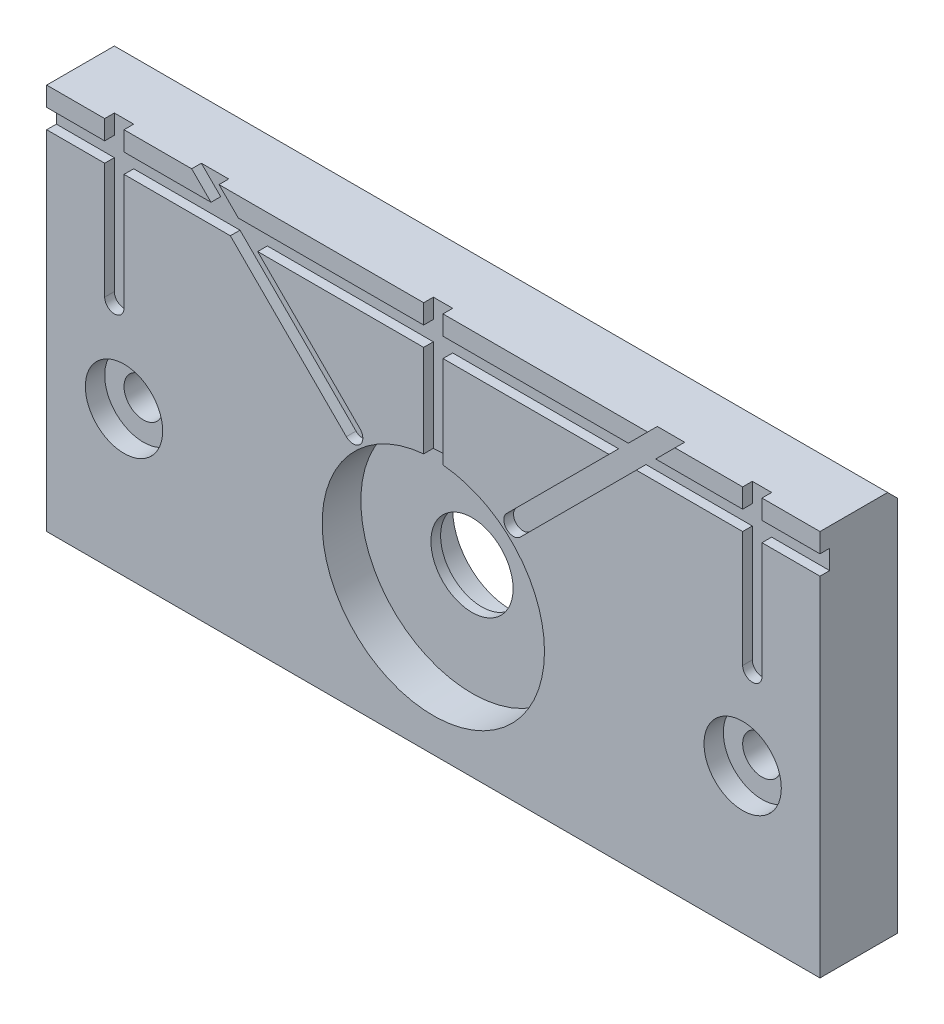
from build123d import *

# Parameters (mm, degrees)
SKETCH_1_W                     = 80
SKETCH_1_H                     = 60
EXTRUDE_1_DEPTH                = 8
HOLE_WIZARD_M3_5_1_D           = 4
HOLE_WIZARD_M3_5_1_CBORE_D     = 8
HOLE_WIZARD_M3_5_1_CBORE_DEPTH = 2
SKETCH_14_W                    = 80
SKETCH_14_H                    = 2
SKETCH_14_W_2                  = 2
SKETCH_14_H_2                  = 16
CUT_EXTRUDE_1_DEPTH            = 1
CUT_EXTRUDE_2_REACH            = 92.174
SKETCH_15_R                    = 4.25
SKETCH_17_R                    = 11.5
CUT_EXTRUDE_4_DEPTH            = 4
SKETCH_18_R                    = 6
CUT_EXTRUDE_5_DEPTH            = 3
CHAMFER_1_SIZE                 = 1.499999999
CHAMFER_1_SIZE2                = 1.500000001
CHAMFER_2_SIZE                 = 1
SKETCH_20_W                    = 80
SKETCH_20_H                    = 6
CUT_EXTRUDE_6_DEPTH            = 1
SKETCH_21_W                    = 80
SKETCH_21_H                    = 4
CUT_EXTRUDE_7_DEPTH            = 1
SKETCH_22_W                    = 80
SKETCH_22_H                    = 2
CUT_EXTRUDE_8_DEPTH            = 1
SKETCH_23_R                    = 1
CUT_EXTRUDE_9_DEPTH            = 1
CUT_EXTRUDE_10_REACH           = 92.174
SKETCH_24_W                    = 80
SKETCH_24_H                    = 20


with BuildPart() as part:
    # 草图1 → 凸台-拉伸1 (new body)
    with BuildSketch(Plane.XY.offset(8)):
        with Locations((40, 10.833333333)):
            Rectangle(SKETCH_1_W, SKETCH_1_H)
    extrude(amount=-EXTRUDE_1_DEPTH)

    # M3.5 六角头机械螺钉的柱形沉头孔1 (through all)
    with Locations(Plane.XY.offset(8)):
        with Locations((8, 15.833333333), (72, 15.833333333)):
            CounterBoreHole(HOLE_WIZARD_M3_5_1_D / 2, HOLE_WIZARD_M3_5_1_CBORE_D / 2, HOLE_WIZARD_M3_5_1_CBORE_DEPTH)

    # 草图14 → 切除-拉伸1 (cut)
    with BuildSketch(Plane.XY.offset(8)):
        with Locations((40, 37.833333333)):
            Rectangle(SKETCH_14_W, SKETCH_14_H)
        Polygon((15, 40.833333333), (31, 24.833333333), (32.414213562, 26.247546896), (16.414213562, 42.247546896), align=None)
        with Locations((7, 32.833333333)):
            Rectangle(SKETCH_14_W_2, SKETCH_14_H_2)
        with Locations((40, 32.833333333)):
            Rectangle(SKETCH_14_W_2, SKETCH_14_H_2)
        with Locations((73, 32.833333333)):
            Rectangle(SKETCH_14_W_2, SKETCH_14_H_2)
        Polygon((47.585786438, 26.247546896), (63.585786438, 42.247546896), (65, 40.833333333), (49, 24.833333333), align=None)
    extrude(amount=-CUT_EXTRUDE_1_DEPTH, mode=Mode.SUBTRACT)

    # 草图15 → 切除-拉伸2 (cut, up to next)
    with BuildSketch(Plane.XY.offset(8), mode=Mode.PRIVATE) as cut_extrude_2_sk1:
        with Locations((40, 15.833333333)):
            Circle(SKETCH_15_R)
    cut_extrude_2_tool1 = extrude(cut_extrude_2_sk1.sketch, amount=-CUT_EXTRUDE_2_REACH, mode=Mode.PRIVATE) & part.part
    add(cut_extrude_2_tool1.solids().sort_by_distance((40, 15.833333, 8))[0], mode=Mode.SUBTRACT)

    # 草图17 → 切除-拉伸4 (cut)
    with BuildSketch(Plane.XY.offset(8)):
        with Locations((40, 15.833333333)):
            Circle(SKETCH_17_R)
    extrude(amount=-CUT_EXTRUDE_4_DEPTH, mode=Mode.SUBTRACT)

    # 草图18 → 切除-拉伸5 (cut)
    with BuildSketch(Plane(origin=(0, 0, 0), x_dir=(-1, 0, 0), z_dir=(0, 0, -1))):
        with Locations((-40, 15.833333333)):
            Circle(SKETCH_18_R)
    extrude(amount=-CUT_EXTRUDE_5_DEPTH, mode=Mode.SUBTRACT)

    # 倒角1
    chamfer_1_edges = [part.edges().sort_by_distance(p)[0] for p in [
        (74, 15.833333333, 0),
        (10, 15.833333333, 0),
    ]]
    chamfer_1_side = [part.faces().sort_by_distance(p)[0] for p in [
        (79, 10.833333333, 0),
    ]]
    chamfer(chamfer_1_edges, length=CHAMFER_1_SIZE, length2=CHAMFER_1_SIZE2, reference=chamfer_1_side[0])

    # 倒角2
    chamfer_2_edges = [part.edges().sort_by_distance(p)[0] for p in [
        (40, 40.833333333, 0),
    ]]
    chamfer(chamfer_2_edges, length=CHAMFER_2_SIZE)

    # 草图20 → 切除-拉伸6 (cut)
    with BuildSketch(Plane.XY.offset(8)):
        with Locations((40, -16.166666667)):
            Rectangle(SKETCH_20_W, SKETCH_20_H)
    extrude(amount=-CUT_EXTRUDE_6_DEPTH, mode=Mode.SUBTRACT)

    # 草图21 → 切除-拉伸7 (cut)
    with BuildSketch(Plane.XY.offset(7)):
        with Locations((40, -17.166666667)):
            Rectangle(SKETCH_21_W, SKETCH_21_H)
    extrude(amount=-CUT_EXTRUDE_7_DEPTH, mode=Mode.SUBTRACT)

    # 草图22 → 切除-拉伸8 (cut)
    with BuildSketch(Plane.XY.offset(6)):
        with Locations((40, -18.166666667)):
            Rectangle(SKETCH_22_W, SKETCH_22_H)
    extrude(amount=-CUT_EXTRUDE_8_DEPTH, mode=Mode.SUBTRACT)

    # 草图23 → 切除-拉伸9 (cut)
    with BuildSketch(Plane.XY.offset(8)):
        with Locations((7, 24.833333333)):
            Circle(SKETCH_23_R)
        with Locations((31.707106781, 25.540440115)):
            Circle(SKETCH_23_R)
        with Locations((48.292893219, 25.540440115)):
            Circle(SKETCH_23_R)
        with Locations((73, 24.833333333)):
            Circle(SKETCH_23_R)
    extrude(amount=-CUT_EXTRUDE_9_DEPTH, mode=Mode.SUBTRACT)

    # 草图24 → 切除-拉伸10 (cut, up to next)
    with BuildSketch(Plane.XY.offset(8), mode=Mode.PRIVATE) as cut_extrude_10_sk1:
        with Locations((40, -9.166666667)):
            Rectangle(SKETCH_24_W, SKETCH_24_H)
    cut_extrude_10_tool1 = extrude(cut_extrude_10_sk1.sketch, amount=-CUT_EXTRUDE_10_REACH, mode=Mode.PRIVATE) & part.part
    add(cut_extrude_10_tool1.solids().sort_by_distance((40, -9.166667, 8))[0], mode=Mode.SUBTRACT)


solid = part.part
